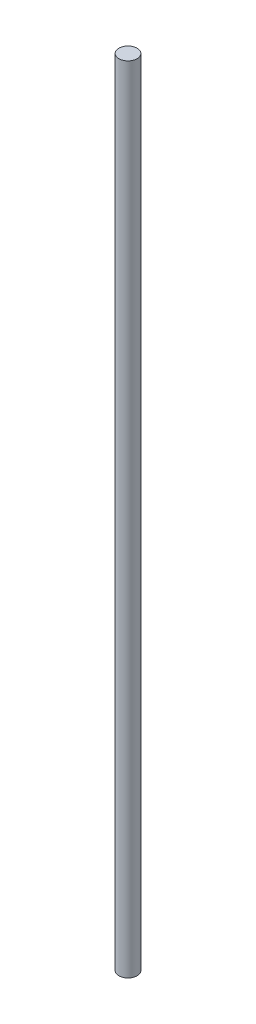
from build123d import *

# Parameters (mm, degrees)
CROQUIS1_R              = 6
SALIENTE_EXTRUIR1_DEPTH = 523


with BuildPart() as part:
    # Croquis1 → Saliente-Extruir1 (new body)
    with BuildSketch(Plane(origin=(0, 0, 0), x_dir=(1, 0, 0), z_dir=(0, 1, 0))):
        with Locations(Location((0, 0, 0), (0, 0, 270))):
            Circle(CROQUIS1_R)
    extrude(amount=SALIENTE_EXTRUIR1_DEPTH)


solid = part.part
